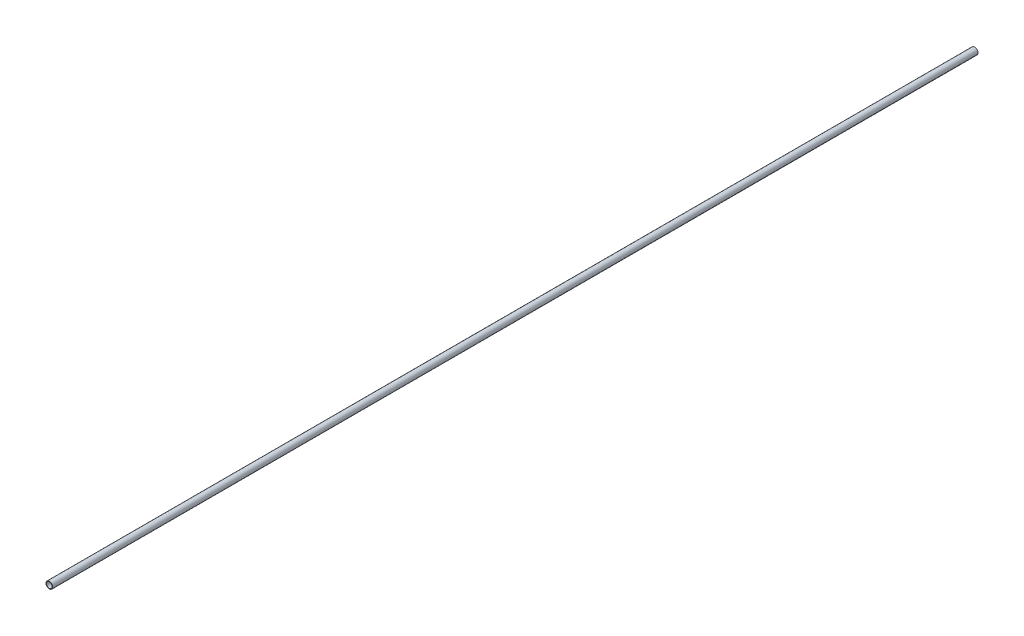
from build123d import *

# Parameters (mm, degrees)
SKETCH1_R           = 38.1
SKETCH1_R_2         = 31.75
BOSS_EXTRUDE1_DEPTH = 10491.986802671


with BuildPart() as part:
    # Sketch1 → Boss-Extrude1 (new body)
    with BuildSketch(Plane.XY):
        Circle(SKETCH1_R)
        Circle(SKETCH1_R_2, mode=Mode.SUBTRACT)
    extrude(amount=BOSS_EXTRUDE1_DEPTH)


solid = part.part
